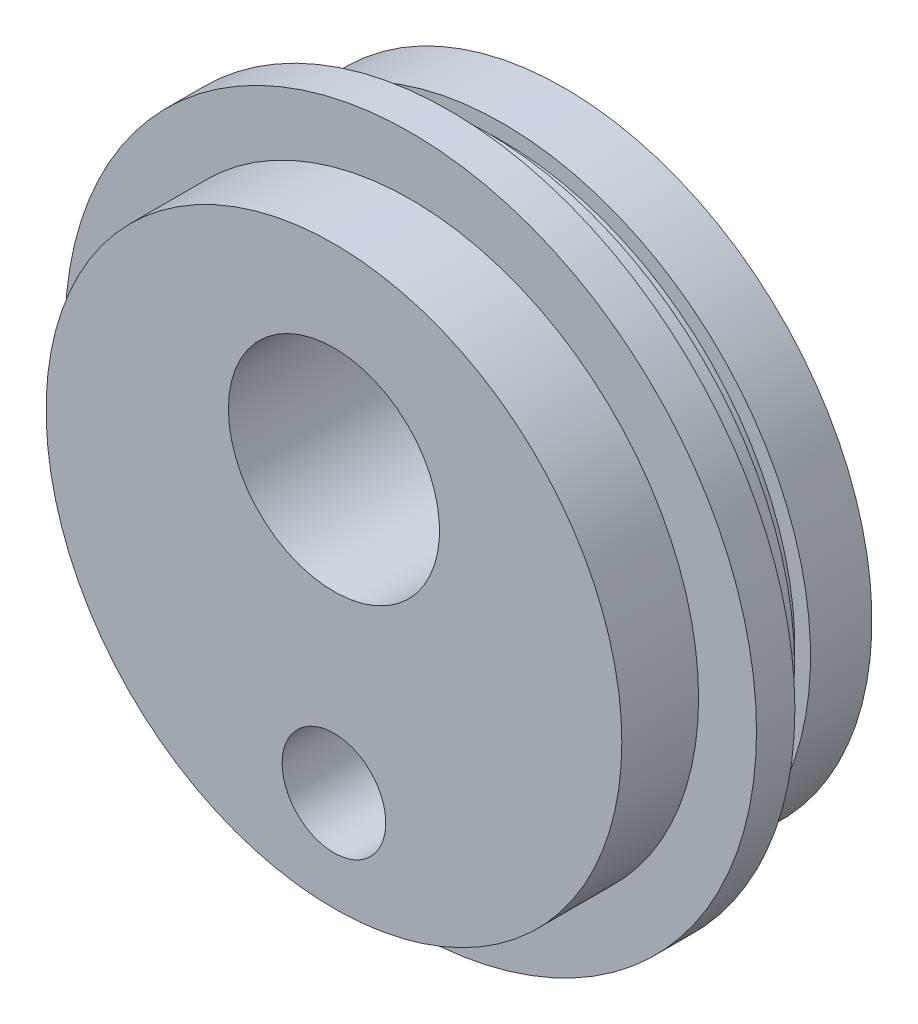
from build123d import *

# Parameters (mm, degrees)
SKETCH1_R               = 50.8
BOSS_EXTRUDE1_DEPTH     = 25.4
CUT_EXTRUDE_THIN2_START = -12.7
SKETCH23_R              = 50.8
SKETCH23_R_2            = 47.625
CUT_EXTRUDE_THIN2_DEPTH = 12.7
SKETCH26_R              = 57.206394865
BOSS_EXTRUDE3_DEPTH     = 6.35
SKETCH31_R              = 48.307957565
BOSS_EXTRUDE4_DEPTH     = 2.54
SKETCH32_R              = 50.900583186
BOSS_EXTRUDE5_DEPTH     = 10.16
CUT_EXTRUDE5_DEPTH      = 85.795655708
CUT_EXTRUDE5_DEPTH_BACK = 85.795655708
SKETCH20_R              = 17.4625
CUT_EXTRUDE6_DEPTH      = 85.795655708
CUT_EXTRUDE6_DEPTH_BACK = 85.795655708
SKETCH21_R              = 8.5725


with BuildPart() as part:
    # Sketch1 → Boss-Extrude1 (new body)
    with BuildSketch(Plane.XY):
        Circle(SKETCH1_R)
    extrude(amount=BOSS_EXTRUDE1_DEPTH)

    # Sketch23 → Cut-Extrude-Thin2 (cut)
    with BuildSketch(Plane.XY.offset(25.4).offset(CUT_EXTRUDE_THIN2_START)):
        Circle(SKETCH23_R)
        Circle(SKETCH23_R_2, mode=Mode.SUBTRACT)
    extrude(amount=CUT_EXTRUDE_THIN2_DEPTH, mode=Mode.SUBTRACT)

    # Sketch26 → Boss-Extrude3 (add)
    with BuildSketch(Plane.XY.offset(12.7)):
        Circle(SKETCH26_R)
    extrude(amount=-BOSS_EXTRUDE3_DEPTH)

    # Sketch31 → Boss-Extrude4 (add)
    with BuildSketch(Plane(origin=(0, 0, 0), x_dir=(-1, 0, 0), z_dir=(0, 0, -1))):
        Circle(SKETCH31_R)
    extrude(amount=BOSS_EXTRUDE4_DEPTH)

    # Sketch32 → Boss-Extrude5 (add)
    with BuildSketch(Plane(origin=(0, 0, -2.54), x_dir=(-1, 0, 0), z_dir=(0, 0, -1))):
        Circle(SKETCH32_R)
    extrude(amount=BOSS_EXTRUDE5_DEPTH)

    # Sketch20 → Cut-Extrude5 (cut, two sides: drawn at the far end of the back side and taken through both)
    with BuildSketch(Plane(origin=(0, 0, 0), x_dir=(-1, 0, 0), z_dir=(0, 0, -1)).offset(-CUT_EXTRUDE5_DEPTH_BACK)):
        with Locations((0, 15.24)):
            Circle(SKETCH20_R)
    extrude(amount=CUT_EXTRUDE5_DEPTH + CUT_EXTRUDE5_DEPTH_BACK, mode=Mode.SUBTRACT)

    # Sketch21 → Cut-Extrude6 (cut, two sides: drawn at the far end of the back side and taken through both)
    with BuildSketch(Plane(origin=(0, 0, 0), x_dir=(-1, 0, 0), z_dir=(0, 0, -1)).offset(-CUT_EXTRUDE6_DEPTH_BACK)):
        with Locations((0, -31.086483225)):
            Circle(SKETCH21_R)
    extrude(amount=CUT_EXTRUDE6_DEPTH + CUT_EXTRUDE6_DEPTH_BACK, mode=Mode.SUBTRACT)


solid = part.part
